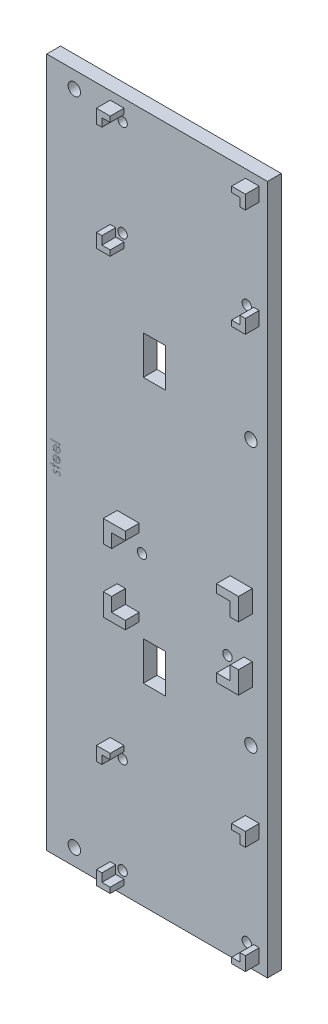
from build123d import *

# Parameters (mm, degrees)
SKETCH_1_W          = 80
SKETCH_1_H          = 250
EXTRUDE_1_DEPTH     = 5
SKETCH_2_W          = 3.589743589
SKETCH_2_H          = 0.314102564
TEMP_DEPTH          = 0.01
EXTRUDE_2_DEPTH     = 5
SKETCH_4_W          = 8
SKETCH_4_H          = 14
CUT_EXTRUDE_1_DEPTH = 10
HOLE_WIZARD_M3_1_D  = 3.4
EXTRUDE_3_DEPTH     = 5
HOLE_WIZARD_M3_2_D  = 3.4
HOLE_WIZARD_M4_1_D  = 4.5


with BuildPart() as part:
    # 스케치1 → 보스-돌출1 (new body)
    with BuildSketch(Plane.XY):
        Rectangle(SKETCH_1_W, SKETCH_1_H)
    extrude(amount=EXTRUDE_1_DEPTH)

    # 스케치2 → temp (cut)
    # profile 1 of 5: a face of its own
    with BuildSketch(Plane(origin=(0, 0, 5), x_dir=(-1, 0, 0), z_dir=(0, 0, -1))):
        with Locations((36.897153237, 4.868589744)):
            Rectangle(SKETCH_2_W, SKETCH_2_H)
    # profile 2 of 5: a face of its own
    with BuildSketch(Plane(origin=(0, 0, 5), x_dir=(-1, 0, 0), z_dir=(0, 0, -1))):
        with BuildLine():
            Line((35.909973749, 3.714543269), (35.763439294, 3.993589744))
            add(Edge.make_bspline(
                [(35.763439294, 3.993589744), (35.723999189, 3.971349949), (35.647264364, 3.928080117), (35.541788067, 3.853723428), (35.447226957, 3.775682471), (35.36504489, 3.69126565), (35.293792114, 3.601512681), (35.231862372, 3.506291719), (35.178507079, 3.405920949), (35.133793844, 3.300046556), (35.099373495, 3.18775382), (35.075072333, 3.068730383), (35.060048206, 2.942759426), (35.058303186, 2.856413171), (35.057409647, 2.812199519)],
                knots=[0, 0, 0, 0, 1.120373846, 2.179803828, 3.190307243, 4.151866639, 5.090753574, 6.023181945, 6.960194942, 7.901556876, 8.864247182, 9.862852693, 10.905672442, 12, 12, 12, 12], degree=3))
            add(Edge.make_bspline(
                [(35.057409647, 2.812199519), (35.058556822, 2.763057542), (35.060794629, 2.667195781), (35.080087092, 2.527656031), (35.111559455, 2.396276623), (35.155524981, 2.273064881), (35.212952362, 2.158322769), (35.282911633, 2.051821392), (35.365044685, 1.953003844), (35.460058102, 1.864972125), (35.561751289, 1.785756106), (35.667666584, 1.715729573), (35.777857851, 1.657594181), (35.890611408, 1.608705044), (36.006964914, 1.571663509), (36.126280672, 1.544549038), (36.249149903, 1.529216946), (36.332242671, 1.526839243), (36.374116378, 1.525641026)],
                knots=[0, 0, 0, 0, 1.145226127, 2.234004399, 3.276654467, 4.290038057, 5.276870678, 6.260645262, 7.254731018, 8.264593254, 9.273837991, 10.257612574, 11.220387342, 12.174754112, 13.118989047, 14.062768009, 15.023752772, 16, 16, 16, 16], degree=3))
            add(Edge.make_bspline(
                [(36.374116378, 1.525641026), (36.413411208, 1.526700167), (36.491288373, 1.528799245), (36.606553917, 1.542030033), (36.71858237, 1.565478326), (36.827466818, 1.59765465), (36.933024952, 1.639205896), (37.035321015, 1.690038115), (37.134246155, 1.750230493), (37.196649289, 1.796703167), (37.228082724, 1.820112179)],
                knots=[0, 0, 0, 0, 1.024358464, 2.0301432, 3.019427413, 4.004406732, 4.986367066, 5.972626655, 6.978780325, 8, 8, 8, 8], degree=3))
            add(Edge.make_bspline(
                [(37.228082724, 1.820112179), (37.265951594, 1.851819862), (37.340489744, 1.914230809), (37.43842807, 2.019787164), (37.520471845, 2.134087361), (37.588478981, 2.255698987), (37.640152628, 2.386035461), (37.678660211, 2.523344752), (37.700238222, 2.669190338), (37.703286055, 2.768895559), (37.704845544, 2.819911859)],
                knots=[0, 0, 0, 0, 1.030682036, 2.02871468, 2.997146059, 3.962720338, 4.930598197, 5.918074684, 6.934738563, 8, 8, 8, 8], degree=3))
            add(Edge.make_bspline(
                [(37.704845544, 2.819911859), (37.703491495, 2.872359464), (37.70083516, 2.97524971), (37.676208827, 3.125281831), (37.637156272, 3.267242548), (37.582002482, 3.401075052), (37.51084293, 3.526792913), (37.422701088, 3.643578962), (37.320283001, 3.753430475), (37.241519792, 3.817339054), (37.201440095, 3.849859776)],
                knots=[0, 0, 0, 0, 1.056321875, 2.072262726, 3.055038591, 4.01806755, 4.982017516, 5.957941055, 6.960871419, 8, 8, 8, 8], degree=3))
            add(Edge.make_bspline(
                [(37.201440095, 3.849859776), (37.171236514, 3.871986714), (37.111030395, 3.916093307), (37.012859238, 3.971340407), (36.910148644, 4.019297802), (36.801238347, 4.057630763), (36.687418767, 4.088670264), (36.567876222, 4.111127083), (36.442646311, 4.124296702), (36.357319755, 4.126885399), (36.313819903, 4.128205128)],
                knots=[0, 0, 0, 0, 0.94817472, 1.890038105, 2.849395472, 3.817997239, 4.812318967, 5.836947057, 6.897266129, 8, 8, 8, 8], degree=3))
            Line((36.313819903, 4.128205128), (36.313819903, 1.83974359))
            add(Edge.make_bspline(
                [(36.313819903, 1.83974359), (36.280120121, 1.841284658), (36.213850857, 1.844315107), (36.116870386, 1.858409469), (36.024532151, 1.880733547), (35.937229583, 1.911764664), (35.854676038, 1.950674482), (35.776302568, 1.996839875), (35.703299422, 2.052252985), (35.634720571, 2.113957579), (35.573671128, 2.182674082), (35.518986686, 2.254940688), (35.473407048, 2.331705913), (35.435852932, 2.412195895), (35.406948769, 2.496828061), (35.38704438, 2.585483396), (35.373747247, 2.677886111), (35.372266204, 2.74087121), (35.371512211, 2.772936699)],
                knots=[0, 0, 0, 0, 1.094405546, 2.152104367, 3.174987145, 4.173015398, 5.153654967, 6.133208507, 7.119289451, 8.123438607, 9.122504012, 10.097966803, 11.060604936, 12.014205423, 12.976096155, 13.956823727, 14.959826266, 16, 16, 16, 16], degree=3))
            add(Edge.make_bspline(
                [(35.371512211, 2.772936699), (35.372116039, 2.804288645), (35.373314149, 2.86649692), (35.385137311, 2.959353444), (35.403941911, 3.050757572), (35.429788021, 3.140052795), (35.461627252, 3.225297606), (35.499792256, 3.304468818), (35.541527279, 3.377833151), (35.590011313, 3.446005912), (35.648741902, 3.512130903), (35.722872007, 3.576900758), (35.809644929, 3.647288238), (35.875219735, 3.691246052), (35.909973749, 3.714543269)],
                knots=[0, 0, 0, 0, 0.990963276, 1.966261236, 2.95471375, 3.93937425, 4.902926125, 5.828461241, 6.715766441, 7.568835615, 8.469155523, 9.505141836, 10.677749234, 12, 12, 12, 12], degree=3))
        make_face()
        with BuildLine():
            add(Edge.make_bspline(
                [(36.627922467, 3.814102564), (36.66959541, 3.802625546), (36.749802409, 3.780535979), (36.860607675, 3.734082223), (36.959655697, 3.682955179), (37.045311049, 3.621244249), (37.120854672, 3.550720669), (37.187539509, 3.470122211), (37.24691063, 3.379638582), (37.297076307, 3.279893019), (37.339762523, 3.17424748), (37.368388614, 3.063642293), (37.3879979, 2.950784241), (37.389824043, 2.87444999), (37.39074298, 2.83603766)],
                knots=[0, 0, 0, 0, 1.154756201, 2.222533969, 3.206705588, 4.129403772, 5.035894089, 5.963342549, 6.920206228, 7.923656548, 8.944970878, 9.96070521, 10.973801891, 12, 12, 12, 12], degree=3))
            add(Edge.make_bspline(
                [(37.39074298, 2.83603766), (37.390128727, 2.80468909), (37.388914477, 2.742719556), (37.377481649, 2.651405948), (37.358337568, 2.563553898), (37.332842628, 2.478679687), (37.297715767, 2.398260643), (37.257363412, 2.320203983), (37.207786601, 2.246437797), (37.170032541, 2.200294567), (37.150959326, 2.176983173)],
                knots=[0, 0, 0, 0, 1.048700258, 2.073059931, 3.073189922, 4.055269162, 5.032885305, 6.005420607, 6.992345662, 8, 8, 8, 8], degree=3))
            add(Edge.make_bspline(
                [(37.150959326, 2.176983173), (37.135865011, 2.160289891), (37.105317795, 2.126506757), (37.052688588, 2.081366235), (36.995937026, 2.038145763), (36.932891901, 1.99881211), (36.864271122, 1.962734523), (36.790653487, 1.928974546), (36.711480357, 1.898588134), (36.656307918, 1.881492024), (36.627922467, 1.872696314)],
                knots=[0, 0, 0, 0, 0.879870761, 1.780643979, 2.707998968, 3.669668524, 4.684282772, 5.740141944, 6.837334558, 8, 8, 8, 8], degree=3))
            Line((36.627922467, 1.872696314), (36.627922467, 3.814102564))
        make_face(mode=Mode.SUBTRACT)
    # profile 3 of 5: a face of its own
    with BuildSketch(Plane(origin=(0, 0, 5), x_dir=(-1, 0, 0), z_dir=(0, 0, -1))):
        with BuildLine():
            Line((35.909973749, 0.573517628), (35.763439294, 0.852564103))
            add(Edge.make_bspline(
                [(35.763439294, 0.852564103), (35.723999189, 0.830324308), (35.647264364, 0.787054476), (35.541788067, 0.712697787), (35.447226957, 0.63465683), (35.36504489, 0.550240009), (35.293792114, 0.46048704), (35.231862372, 0.365266077), (35.178507079, 0.264895308), (35.133793844, 0.159020915), (35.099373495, 0.046728179), (35.075072333, -0.072295258), (35.060048206, -0.198266215), (35.058303186, -0.28461247), (35.057409647, -0.328826122)],
                knots=[0, 0, 0, 0, 1.120373846, 2.179803828, 3.190307243, 4.151866639, 5.090753574, 6.023181945, 6.960194942, 7.901556876, 8.864247182, 9.862852693, 10.905672442, 12, 12, 12, 12], degree=3))
            add(Edge.make_bspline(
                [(35.057409647, -0.328826122), (35.058556822, -0.377968099), (35.060794629, -0.47382986), (35.080087092, -0.613369611), (35.111559455, -0.744749018), (35.155524981, -0.86796076), (35.212952362, -0.982702872), (35.282911633, -1.089204249), (35.365044685, -1.188021797), (35.460058102, -1.276053516), (35.561751289, -1.355269535), (35.667666584, -1.425296068), (35.777857851, -1.48343146), (35.890611408, -1.532320597), (36.006964914, -1.569362132), (36.126280672, -1.596476603), (36.249149903, -1.611808695), (36.332242671, -1.614186398), (36.374116378, -1.615384615)],
                knots=[0, 0, 0, 0, 1.145226127, 2.234004399, 3.276654467, 4.290038057, 5.276870678, 6.260645262, 7.254731018, 8.264593254, 9.273837991, 10.257612574, 11.220387342, 12.174754112, 13.118989047, 14.062768009, 15.023752772, 16, 16, 16, 16], degree=3))
            add(Edge.make_bspline(
                [(36.374116378, -1.615384615), (36.413411208, -1.614325474), (36.491288373, -1.612226396), (36.606553917, -1.598995608), (36.71858237, -1.575547315), (36.827466818, -1.543370991), (36.933024952, -1.501819745), (37.035321015, -1.450987526), (37.134246155, -1.390795148), (37.196649289, -1.344322474), (37.228082724, -1.320913462)],
                knots=[0, 0, 0, 0, 1.024358464, 2.0301432, 3.019427413, 4.004406732, 4.986367066, 5.972626655, 6.978780325, 8, 8, 8, 8], degree=3))
            add(Edge.make_bspline(
                [(37.228082724, -1.320913462), (37.265951594, -1.289205779), (37.340489744, -1.226794832), (37.43842807, -1.121238477), (37.520471845, -1.00693828), (37.588478981, -0.885326654), (37.640152628, -0.75499018), (37.678660211, -0.617680889), (37.700238222, -0.471835303), (37.703286055, -0.372130082), (37.704845544, -0.321113782)],
                knots=[0, 0, 0, 0, 1.030682036, 2.02871468, 2.997146059, 3.962720338, 4.930598197, 5.918074684, 6.934738563, 8, 8, 8, 8], degree=3))
            add(Edge.make_bspline(
                [(37.704845544, -0.321113782), (37.703491495, -0.268666177), (37.70083516, -0.165775931), (37.676208827, -0.01574381), (37.637156272, 0.126216907), (37.582002482, 0.260049411), (37.51084293, 0.385767272), (37.422701088, 0.502553321), (37.320283001, 0.612404834), (37.241519792, 0.676313413), (37.201440095, 0.708834135)],
                knots=[0, 0, 0, 0, 1.056321875, 2.072262726, 3.055038591, 4.01806755, 4.982017516, 5.957941055, 6.960871419, 8, 8, 8, 8], degree=3))
            add(Edge.make_bspline(
                [(37.201440095, 0.708834135), (37.171236514, 0.730961073), (37.111030395, 0.775067666), (37.012859238, 0.830314766), (36.910148644, 0.878272161), (36.801238347, 0.916605122), (36.687418767, 0.947644623), (36.567876222, 0.970101442), (36.442646311, 0.983271061), (36.357319755, 0.985859758), (36.313819903, 0.987179487)],
                knots=[0, 0, 0, 0, 0.94817472, 1.890038105, 2.849395472, 3.817997239, 4.812318967, 5.836947057, 6.897266129, 8, 8, 8, 8], degree=3))
            Line((36.313819903, 0.987179487), (36.313819903, -1.301282051))
            add(Edge.make_bspline(
                [(36.313819903, -1.301282051), (36.280120121, -1.299740983), (36.213850857, -1.296710534), (36.116870386, -1.282616172), (36.024532151, -1.260292094), (35.937229583, -1.229260977), (35.854676038, -1.190351159), (35.776302568, -1.144185766), (35.703299422, -1.088772656), (35.634720571, -1.027068062), (35.573671128, -0.958351559), (35.518986686, -0.886084953), (35.473407048, -0.809319728), (35.435852932, -0.728829746), (35.406948769, -0.64419758), (35.38704438, -0.555542245), (35.373747247, -0.46313953), (35.372266204, -0.400154431), (35.371512211, -0.368088942)],
                knots=[0, 0, 0, 0, 1.094405546, 2.152104367, 3.174987145, 4.173015398, 5.153654967, 6.133208507, 7.119289451, 8.123438607, 9.122504012, 10.097966803, 11.060604936, 12.014205423, 12.976096155, 13.956823727, 14.959826266, 16, 16, 16, 16], degree=3))
            add(Edge.make_bspline(
                [(35.371512211, -0.368088942), (35.372116039, -0.336736996), (35.373314149, -0.274528721), (35.385137311, -0.181672197), (35.403941911, -0.090268069), (35.429788021, -0.000972846), (35.461627252, 0.084271965), (35.499792256, 0.163443177), (35.541527279, 0.236807509), (35.590011313, 0.304980271), (35.648741902, 0.371105262), (35.722872007, 0.435875117), (35.809644929, 0.506262597), (35.875219735, 0.550220411), (35.909973749, 0.573517628)],
                knots=[0, 0, 0, 0, 0.990963276, 1.966261236, 2.95471375, 3.93937425, 4.902926125, 5.828461241, 6.715766441, 7.568835615, 8.469155523, 9.505141836, 10.677749234, 12, 12, 12, 12], degree=3))
        make_face()
        with BuildLine():
            add(Edge.make_bspline(
                [(36.627922467, 0.673076923), (36.66959541, 0.661599905), (36.749802409, 0.639510338), (36.860607675, 0.593056582), (36.959655697, 0.541929538), (37.045311049, 0.480218608), (37.120854672, 0.409695028), (37.187539509, 0.32909657), (37.24691063, 0.238612941), (37.297076307, 0.138867378), (37.339762523, 0.033221839), (37.368388614, -0.077383348), (37.3879979, -0.1902414), (37.389824043, -0.266575651), (37.39074298, -0.304987981)],
                knots=[0, 0, 0, 0, 1.154756201, 2.222533969, 3.206705588, 4.129403772, 5.035894089, 5.963342549, 6.920206228, 7.923656548, 8.944970878, 9.96070521, 10.973801891, 12, 12, 12, 12], degree=3))
            add(Edge.make_bspline(
                [(37.39074298, -0.304987981), (37.390128727, -0.336336551), (37.388914477, -0.398306085), (37.377481649, -0.489619693), (37.358337568, -0.577471743), (37.332842628, -0.662345954), (37.297715767, -0.742764998), (37.257363412, -0.820821658), (37.207786601, -0.894587844), (37.170032541, -0.940731074), (37.150959326, -0.964042468)],
                knots=[0, 0, 0, 0, 1.048700258, 2.073059931, 3.073189922, 4.055269162, 5.032885305, 6.005420607, 6.992345662, 8, 8, 8, 8], degree=3))
            add(Edge.make_bspline(
                [(37.150959326, -0.964042468), (37.135865011, -0.98073575), (37.105317795, -1.014518884), (37.052688588, -1.059659406), (36.995937026, -1.102879878), (36.932891901, -1.142213531), (36.864271122, -1.178291118), (36.790653487, -1.212051095), (36.711480357, -1.242437507), (36.656307918, -1.259533617), (36.627922467, -1.268329327)],
                knots=[0, 0, 0, 0, 0.879870761, 1.780643979, 2.707998968, 3.669668524, 4.684282772, 5.740141944, 6.837334558, 8, 8, 8, 8], degree=3))
            Line((36.627922467, -1.268329327), (36.627922467, 0.673076923))
        make_face(mode=Mode.SUBTRACT)
    # profile 4 of 5: a face of its own
    with BuildSketch(Plane(origin=(0, 0, 5), x_dir=(-1, 0, 0), z_dir=(0, 0, -1))):
        Polygon((38.692025031, -2.871794872), (38.692025031, -2.557692308), (37.659973749, -2.557692308), (37.659973749, -2.108974359), (37.345871185, -2.108974359), (37.345871185, -2.557692308), (35.102281442, -2.557692308), (35.102281442, -2.871794872), (37.345871185, -2.871794872), (37.345871185, -3.320512821), (37.659973749, -3.320512821), (37.659973749, -2.871794872), align=None)
    # profile 5 of 5: a face of its own
    with BuildSketch(Plane(origin=(0, 0, 5), x_dir=(-1, 0, 0), z_dir=(0, 0, -1))):
        with BuildLine():
            Line((37.340963333, -3.858974359), (37.121512211, -4.072115385))
            add(Edge.make_bspline(
                [(37.121512211, -4.072115385), (37.142829965, -4.090502871), (37.183928085, -4.12595178), (37.238803673, -4.182223517), (37.285271705, -4.238259277), (37.323506944, -4.293763513), (37.35359843, -4.348839804), (37.37485173, -4.403958396), (37.388194475, -4.458968036), (37.389903681, -4.495757023), (37.39074298, -4.513822115)],
                knots=[0, 0, 0, 0, 1.265880991, 2.440469525, 3.530740057, 4.536711111, 5.468008477, 6.34654737, 7.188078389, 8, 8, 8, 8], degree=3))
            add(Edge.make_bspline(
                [(37.39074298, -4.513822115), (37.389657622, -4.53595532), (37.387521792, -4.579510335), (37.366625487, -4.64183119), (37.333780003, -4.699281042), (37.288122909, -4.7494369), (37.23508842, -4.791694932), (37.176511171, -4.823724148), (37.112826752, -4.842479812), (37.068814654, -4.844917484), (37.046492179, -4.846153846)],
                knots=[0, 0, 0, 0, 1.000196853, 1.968245854, 2.94569445, 3.981000421, 5.021494845, 6.007172807, 6.989258906, 8, 8, 8, 8], degree=3))
            add(Edge.make_bspline(
                [(37.046492179, -4.846153846), (37.026280135, -4.845043034), (36.985913024, -4.842824541), (36.92636499, -4.825577862), (36.868307952, -4.798111789), (36.832745045, -4.772441595), (36.814420865, -4.759214744)],
                knots=[0, 0, 0, 0, 0.960159726, 1.917612774, 2.927026955, 4, 4, 4, 4], degree=3))
            add(Edge.make_bspline(
                [(36.814420865, -4.759214744), (36.80463628, -4.75125125), (36.783811026, -4.734301957), (36.754907172, -4.702493442), (36.722964921, -4.666470939), (36.691028084, -4.623151001), (36.657396359, -4.574399974), (36.623394226, -4.519160689), (36.586429801, -4.459186184), (36.562985366, -4.416248878), (36.55079907, -4.393930288)],
                knots=[0, 0, 0, 0, 0.66740084, 1.420478572, 2.27185888, 3.217733974, 4.268547843, 5.408967954, 6.65319498, 8, 8, 8, 8], degree=3))
            add(Edge.make_bspline(
                [(36.55079907, -4.393930288), (36.535554167, -4.366716711), (36.506106035, -4.314149041), (36.460396331, -4.239456274), (36.414964907, -4.171669233), (36.370297633, -4.110213565), (36.325144765, -4.056271757), (36.281237008, -4.008207204), (36.2372477, -3.96721876), (36.206514586, -3.944264833), (36.191824711, -3.933293269)],
                knots=[0, 0, 0, 0, 1.27191281, 2.456916733, 3.569705269, 4.599008579, 5.553216877, 6.436649441, 7.252746552, 8, 8, 8, 8], degree=3))
            add(Edge.make_bspline(
                [(36.191824711, -3.933293269), (36.162190908, -3.914991464), (36.103286622, -3.878612241), (36.005633409, -3.841899714), (35.902911156, -3.818434372), (35.832280997, -3.815562059), (35.796392019, -3.814102564)],
                knots=[0, 0, 0, 0, 0.995606783, 1.979007074, 2.973082153, 4, 4, 4, 4], degree=3))
            add(Edge.make_bspline(
                [(35.796392019, -3.814102564), (35.771122055, -3.814820447), (35.721324831, -3.816235113), (35.648001733, -3.826116875), (35.577824046, -3.842984742), (35.510381122, -3.866364495), (35.445804421, -3.896345462), (35.384580392, -3.934026677), (35.326189048, -3.977716272), (35.270958611, -4.027158131), (35.220849552, -4.082071009), (35.177255307, -4.141119147), (35.140437266, -4.203413291), (35.110211603, -4.268968636), (35.086132535, -4.337924514), (35.069472975, -4.410337941), (35.059499405, -4.485966113), (35.058115041, -4.537396002), (35.057409647, -4.563601763)],
                knots=[0, 0, 0, 0, 1.032633728, 2.034917567, 3.017159222, 3.977707287, 4.947659047, 5.920662675, 6.910168127, 7.92466491, 8.94557085, 9.942744688, 10.919024275, 11.897637117, 12.88838639, 13.898512555, 14.929200919, 16, 16, 16, 16], degree=3))
            add(Edge.make_bspline(
                [(35.057409647, -4.563601763), (35.058402347, -4.598968938), (35.060373954, -4.669211865), (35.078880015, -4.773101584), (35.107675409, -4.874622343), (35.147391344, -4.973005883), (35.197542056, -5.066051997), (35.25760445, -5.151182922), (35.325594447, -5.228694384), (35.377707358, -5.272812658), (35.403763813, -5.294871795)],
                knots=[0, 0, 0, 0, 1.013940152, 2.01379169, 3.017749504, 4.037548394, 5.051665909, 6.043208538, 7.021604269, 8, 8, 8, 8], degree=3))
            Line((35.403763813, -5.294871795), (35.64074298, -5.086638622))
            add(Edge.make_bspline(
                [(35.64074298, -5.086638622), (35.619388216, -5.066866209), (35.577988776, -5.028534397), (35.522864435, -4.96723318), (35.476663164, -4.904853779), (35.438019749, -4.842019092), (35.408244346, -4.777798998), (35.387325752, -4.712553384), (35.37388156, -4.64641496), (35.372303277, -4.601992824), (35.371512211, -4.579727564)],
                knots=[0, 0, 0, 0, 1.179806542, 2.287233372, 3.337373186, 4.324005949, 5.273901747, 6.200048787, 7.097828587, 8, 8, 8, 8], degree=3))
            add(Edge.make_bspline(
                [(35.371512211, -4.579727564), (35.372883036, -4.549409638), (35.375561398, -4.490173497), (35.39987849, -4.405329738), (35.438008441, -4.326991111), (35.49209314, -4.258967766), (35.555048712, -4.201065605), (35.625962831, -4.159137431), (35.702754288, -4.132861255), (35.755986591, -4.129775256), (35.783070704, -4.128205128)],
                knots=[0, 0, 0, 0, 1.072336372, 2.095165389, 3.102688358, 4.141489647, 5.156069229, 6.117746104, 7.042326257, 8, 8, 8, 8], degree=3))
            add(Edge.make_bspline(
                [(35.783070704, -4.128205128), (35.805380323, -4.129291423), (35.849427679, -4.131436165), (35.91317802, -4.148279437), (35.9736473, -4.17489229), (36.009036948, -4.201096938), (36.027061089, -4.214443109)],
                knots=[0, 0, 0, 0, 1.013901739, 2.00181326, 2.98231254, 4, 4, 4, 4], degree=3))
            add(Edge.make_bspline(
                [(36.027061089, -4.214443109), (36.036096451, -4.222465503), (36.055778733, -4.239941176), (36.084203812, -4.271996417), (36.114841911, -4.310378279), (36.1471735, -4.355518442), (36.180772105, -4.407507904), (36.215461458, -4.46655738), (36.252889184, -4.531857932), (36.277708839, -4.578028563), (36.290682884, -4.602163462)],
                knots=[0, 0, 0, 0, 0.615000592, 1.339693406, 2.178160186, 3.116406724, 4.166410947, 5.330106347, 6.604359322, 8, 8, 8, 8], degree=3))
            add(Edge.make_bspline(
                [(36.290682884, -4.602163462), (36.305222016, -4.628210102), (36.333418032, -4.678722849), (36.377334112, -4.75027014), (36.422001387, -4.814817494), (36.464914226, -4.873918069), (36.50833517, -4.926079074), (36.552312421, -4.971095023), (36.595072408, -5.010738239), (36.625369704, -5.03268565), (36.639841538, -5.043169071)],
                knots=[0, 0, 0, 0, 1.262093308, 2.447601706, 3.550203992, 4.582594899, 5.537233252, 6.418365656, 7.244515135, 8, 8, 8, 8], degree=3))
            add(Edge.make_bspline(
                [(36.639841538, -5.043169071), (36.668987153, -5.06129967), (36.727288568, -5.097567205), (36.824599045, -5.132782397), (36.927044102, -5.156988425), (36.997730957, -5.159150816), (37.033871987, -5.16025641)],
                knots=[0, 0, 0, 0, 0.985009483, 1.970363186, 2.962279964, 4, 4, 4, 4], degree=3))
            add(Edge.make_bspline(
                [(37.033871987, -5.16025641), (37.057497331, -5.159722138), (37.103735476, -5.15867649), (37.171675055, -5.150333528), (37.236220442, -5.135137843), (37.298357328, -5.116097315), (37.356822742, -5.089561632), (37.412735609, -5.058045711), (37.465050606, -5.020014125), (37.514029147, -4.977266109), (37.558980361, -4.930794153), (37.597524691, -4.879896372), (37.630670707, -4.826394323), (37.658425304, -4.76997626), (37.679429556, -4.710158407), (37.693886155, -4.647343303), (37.703541573, -4.581662344), (37.704404627, -4.536761191), (37.704845544, -4.513822115)],
                knots=[0, 0, 0, 0, 1.087761869, 2.12890409, 3.144425528, 4.138218063, 5.116152125, 6.094559764, 7.089109474, 8.088306095, 9.085414286, 10.060442677, 11.0220762, 11.979848209, 12.949875201, 13.933947973, 14.944496518, 16, 16, 16, 16], degree=3))
            add(Edge.make_bspline(
                [(37.704845544, -4.513822115), (37.703743789, -4.486628717), (37.70151961, -4.431731802), (37.683773594, -4.349397991), (37.654873797, -4.267278731), (37.614022156, -4.185289857), (37.562640315, -4.10308206), (37.499396271, -4.021023827), (37.426075237, -3.937781965), (37.369967871, -3.885830511), (37.340963333, -3.858974359)],
                knots=[0, 0, 0, 0, 0.845753203, 1.707371858, 2.609134499, 3.549244224, 4.552329203, 5.621587647, 6.770486714, 8, 8, 8, 8], degree=3))
        make_face()
    extrude(amount=TEMP_DEPTH, mode=Mode.SUBTRACT)

    # 스케치3 → 보스-돌출2 (add)
    with BuildSketch(Plane.XY.offset(5)):
        Polygon((-12, -78), (-17, -78), (-17, -83), (-15, -83), (-15, -80), (-12, -80), align=None)
        Polygon((32, -80), (32, -78), (37, -78), (37, -83), (35, -83), (35, -80), align=None)
        Polygon((32, -122), (37, -122), (37, -117), (35, -117), (35, -120), (32, -120), align=None)
        Polygon((-12, -120), (-12, -122), (-17, -122), (-17, -117), (-15, -117), (-15, -120), align=None)
        Polygon((-12, 122), (-17, 122), (-17, 117), (-15, 117), (-15, 120), (-12, 120), align=None)
        Polygon((32, 120), (32, 122), (37, 122), (37, 117), (35, 117), (35, 120), align=None)
        Polygon((32, 78), (37, 78), (37, 83), (35, 83), (35, 80), (32, 80), align=None)
        Polygon((-12, 80), (-12, 78), (-17, 78), (-17, 83), (-15, 83), (-15, 80), align=None)
    extrude(amount=EXTRUDE_2_DEPTH)

    # 스케치4 → 컷-돌출1 (cut)
    with BuildSketch(Plane.XY.offset(5)):
        with Locations((-1, -48)):
            Rectangle(SKETCH_4_W, SKETCH_4_H)
        with Locations((-1, 48)):
            Rectangle(SKETCH_4_W, SKETCH_4_H)
    extrude(amount=-CUT_EXTRUDE_1_DEPTH, mode=Mode.SUBTRACT)

    # M3 여유 구멍1 (through all)
    with Locations(Plane.XY.offset(5)):
        with Locations((-12.5, 82.5), (32.5, 82.5), (32.5, 117.5), (-12.5, 117.5), (32.5, -82.5), (-12.5, -82.5), (-12.5, -117.5), (32.5, -117.5)):
            Hole(HOLE_WIZARD_M3_1_D / 2)

    # 스케치9 → 보스-돌출3 (add)
    with BuildSketch(Plane.XY.offset(5)):
        Polygon((-14.5, -36.5), (-14.5, -28.5), (-11.5, -28.5), (-11.5, -33.5), (-6.5, -33.5), (-6.5, -36.5), align=None)
        Polygon((26.5, -33.5), (26.5, -36.5), (34.5, -36.5), (34.5, -28.5), (31.5, -28.5), (31.5, -33.5), align=None)
        Polygon((34.5, -5.5), (34.5, -13.5), (31.5, -13.5), (31.5, -8.5), (26.5, -8.5), (26.5, -5.5), align=None)
        Polygon((-6.5, -8.5), (-6.5, -5.5), (-14.5, -5.5), (-14.5, -13.5), (-11.5, -13.5), (-11.5, -8.5), align=None)
    extrude(amount=EXTRUDE_3_DEPTH)

    # M3 여유 구멍2 (through all)
    with Locations(Plane.XY.offset(5)):
        with Locations((-5.5, -14.5), (25.5, -31)):
            Hole(HOLE_WIZARD_M3_2_D / 2)

    # M4 여유 구멍1 (through all)
    with Locations(Plane.XY.offset(5)):
        with Locations((-30, -119), (34, -55), (34, 41), (-30, 119)):
            Hole(HOLE_WIZARD_M4_1_D / 2)


solid = part.part
